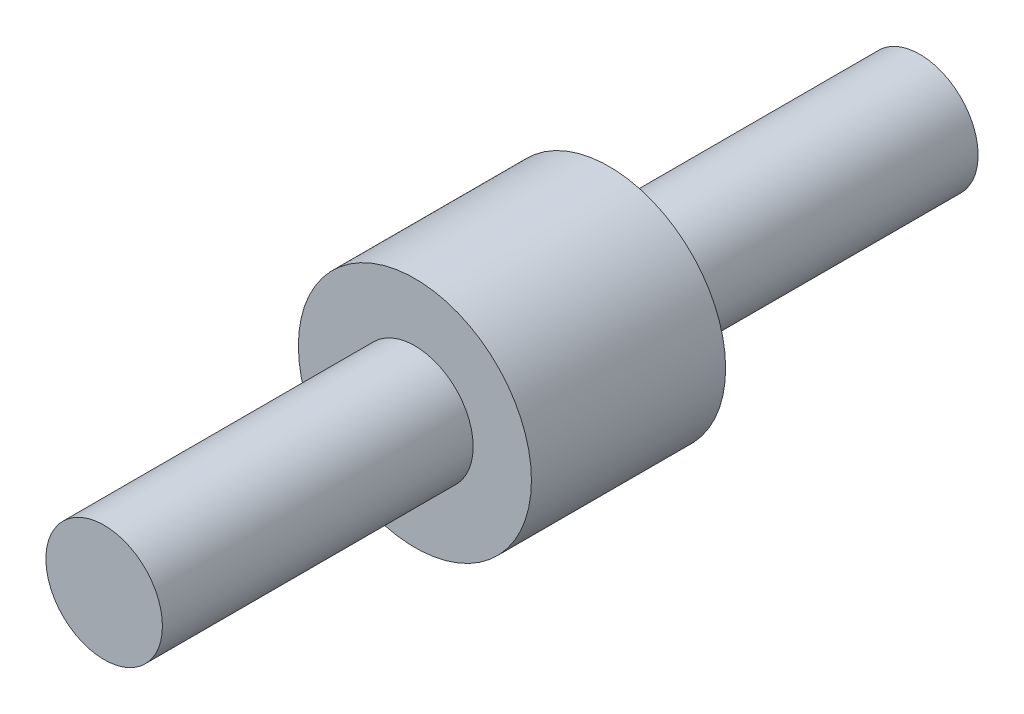
from build123d import *

# Parameters (mm, degrees)
SKETCH1_R                                        = 3
BOSS_EXTRUDE1_DLUGOSC_CALKOWITA_S4_DEPTH         = 5
BOSS_EXTRUDE2_PRZEDLUZENIE_DO_MONTAZU_DEPTH      = 8
BOSS_EXTRUDE2_PRZEDLUZENIE_DO_MONTAZU_DEPTH_BACK = 13
SKETCH2_R                                        = 1.5


with BuildPart() as part:
    # Sketch1 → Boss-Extrude1 dlugosc calkowita S4 (new body)
    with BuildSketch(Plane.XY):
        Circle(SKETCH1_R)
    extrude(amount=BOSS_EXTRUDE1_DLUGOSC_CALKOWITA_S4_DEPTH)

    # Sketch2 → Boss-Extrude2 przedluzenie do montazu (add, two sides: drawn at the far end of the back side and taken through both)
    with BuildSketch(Plane(origin=(0, 0, 0), x_dir=(-1, 0, 0), z_dir=(0, 0, -1)).offset(-BOSS_EXTRUDE2_PRZEDLUZENIE_DO_MONTAZU_DEPTH_BACK)):
        Circle(SKETCH2_R)
    extrude(amount=BOSS_EXTRUDE2_PRZEDLUZENIE_DO_MONTAZU_DEPTH + BOSS_EXTRUDE2_PRZEDLUZENIE_DO_MONTAZU_DEPTH_BACK)


solid = part.part
